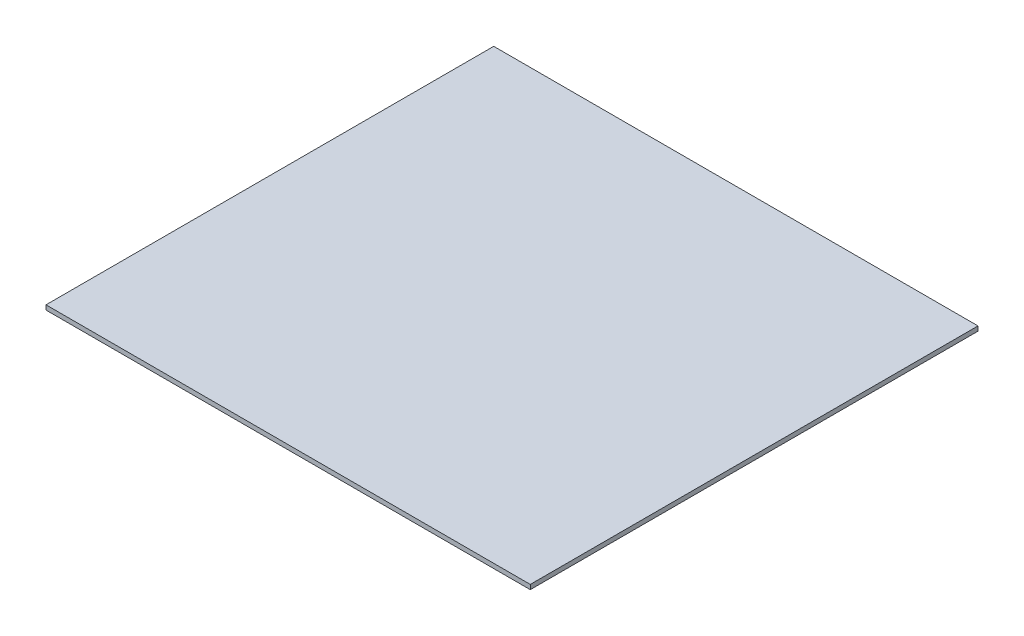
from build123d import *

# Parameters (mm, degrees)
SKETCH1_W           = 106
SKETCH1_H           = 98
BOSS_EXTRUDE1_DEPTH = 1


with BuildPart() as part:
    # Sketch1 → Boss-Extrude1 (new body)
    with BuildSketch(Plane(origin=(0, 0, 0), x_dir=(1, 0, 0), z_dir=(0, 1, 0))):
        Rectangle(SKETCH1_W, SKETCH1_H)
    extrude(amount=BOSS_EXTRUDE1_DEPTH)


solid = part.part
